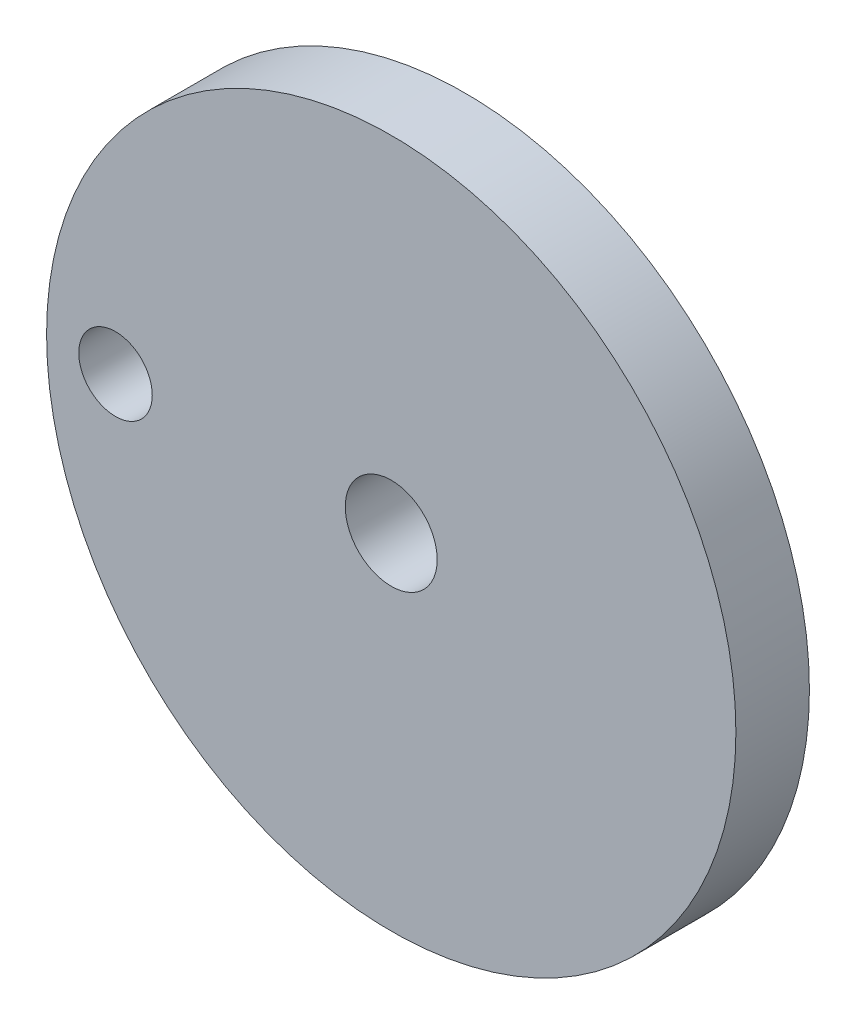
from build123d import *

# Parameters (mm, degrees)
SKETCH_1_R          = 37.5
EXTRUDE_1_DEPTH     = 8
SKETCH_2_R          = 4
CUT_EXTRUDE_1_DEPTH = 13
SKETCH_3_R          = 5
CUT_EXTRUDE_2_DEPTH = 13


with BuildPart() as part:
    # 草图1 → 凸台-拉伸1 (new body)
    with BuildSketch(Plane.XY):
        Circle(SKETCH_1_R)
    extrude(amount=EXTRUDE_1_DEPTH)

    # 草图2 → 切除-拉伸1 (cut)
    with BuildSketch(Plane.XY.offset(8)):
        with Locations((-30, 0)):
            Circle(SKETCH_2_R)
    extrude(amount=-CUT_EXTRUDE_1_DEPTH, mode=Mode.SUBTRACT)

    # 草图3 → 切除-拉伸2 (cut)
    with BuildSketch(Plane.XY.offset(8)):
        Circle(SKETCH_3_R)
    extrude(amount=-CUT_EXTRUDE_2_DEPTH, mode=Mode.SUBTRACT)


solid = part.part
